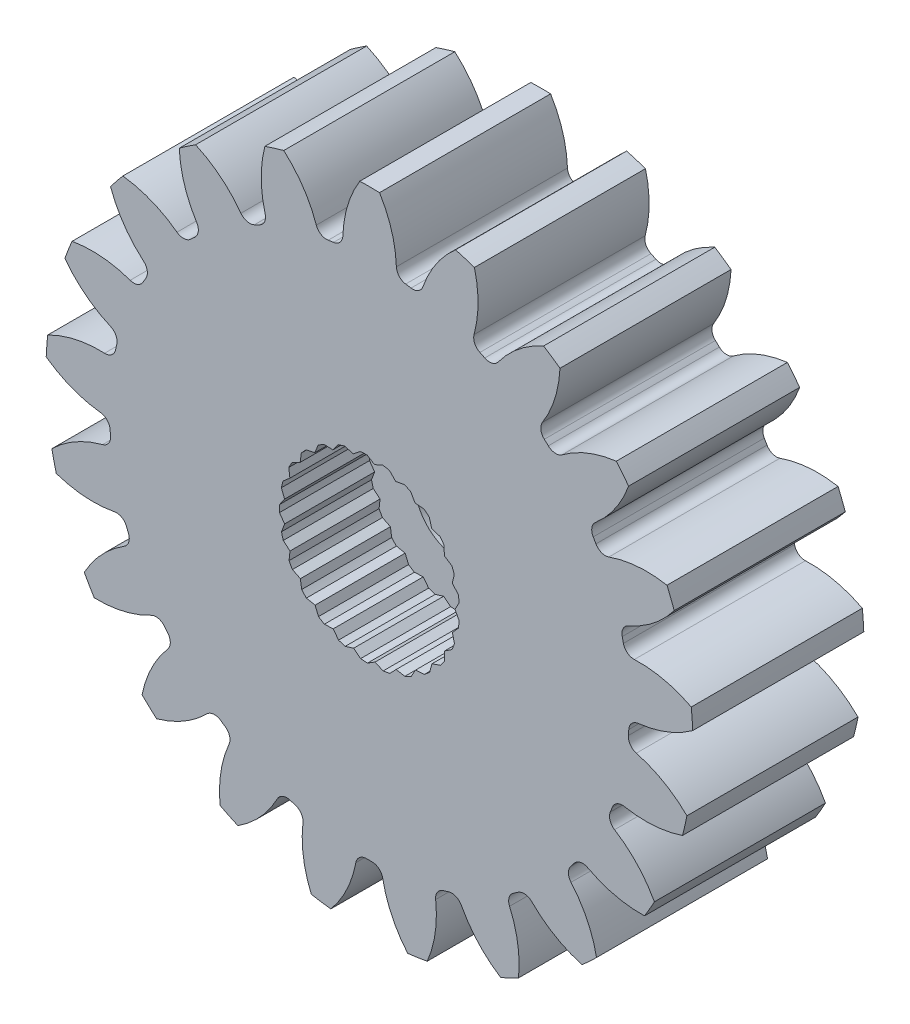
from build123d import *

# Parameters (mm, degrees)
SKETCH3_R           = 9.128125
GEARBODY_DEPTH      = 4.825999939
TOOTHCUT_DEPTH      = 14.781712791
CIRPATTERN1_COUNT   = 21
BOREDIA_R           = 3.175
BORE_DEPTH          = 12700
BOSS_EXTRUDE2_START = -4.825999939
SKETCH5_R           = 3.175
SKETCH5_R_2         = 1.27
BOSS_EXTRUDE2_DEPTH = 4.825999939
CUT_EXTRUDE1_DEPTH  = 2.54


with BuildPart() as part:
    # Sketch3 → gearBody (new body)
    with BuildSketch(Plane.XY):
        Circle(SKETCH3_R)
    extrude(amount=GEARBODY_DEPTH)

    # Sketch2 → toothCut (cut, through all)
    with BuildSketch(Plane.XY):
        with BuildLine():
            ThreePointArc((7.304063332, -0.62874438), (7.31024236, -0.552283711), (7.315621001, -0.475762574))
            ThreePointArc((7.315621001, -0.475762574), (7.399225293, -0.285539875), (7.585558497, -0.193592662))
            ThreePointArc((7.585558497, -0.193592662), (8.887880924, 0.24520489), (9.887327956, 1.188440081))
            ThreePointArc((9.887327956, 1.188440081), (9.930197113, -0.750219466), (9.596548254, -2.660433339))
            ThreePointArc((9.596548254, -2.660433339), (8.750158222, -1.577746445), (7.528543363, -0.948267191))
            ThreePointArc((7.528543363, -0.948267191), (7.358139402, -0.829368735), (7.304063332, -0.62874438))
        make_face()
    toothcut = extrude(amount=TOOTHCUT_DEPTH, mode=Mode.SUBTRACT)

    # CirPattern1: toothCut ×21 about axis
    cirpattern1_axis = Axis((0, 0, 0), (0, 0, 1))
    for i in range(1, CIRPATTERN1_COUNT):
        add(toothcut.rotate(cirpattern1_axis, i * 360 / CIRPATTERN1_COUNT), mode=Mode.SUBTRACT)

    # boreDia → bore (cut, symmetric)
    with BuildSketch(Plane.XY):
        Circle(BOREDIA_R)
    extrude(amount=BORE_DEPTH, both=True, mode=Mode.SUBTRACT)

    # Sketch5 → Boss-Extrude2 (add)
    with BuildSketch(Plane(origin=(0, 0, 0), x_dir=(-1, 0, 0), z_dir=(0, 0, -1)).offset(BOSS_EXTRUDE2_START)):
        Circle(SKETCH5_R)
        Circle(SKETCH5_R_2, mode=Mode.SUBTRACT)
    extrude(amount=BOSS_EXTRUDE2_DEPTH)

    # Sketch4 → Cut-Extrude1 (cut)
    with BuildSketch(Plane.XY.offset(4.825999939)):
        with BuildLine():
            Line((-2.483961558, 0.5305987), (-2.394716355, 0.296483692))
            Line((-2.394716355, 0.296483692), (-2.538362097, 0.091202315))
            ThreePointArc((-2.538362097, 0.091202315), (-2.539992169, -0.006307068), (-2.537877868, -0.103807154))
            Line((-2.537877868, -0.103807154), (-2.393214433, -0.308372628))
            Line((-2.393214433, -0.308372628), (-2.481295878, -0.542927957))
            ThreePointArc((-2.481295878, -0.542927957), (-2.458625141, -0.637779286), (-2.432329979, -0.731690422))
            Line((-2.432329979, -0.731690422), (-2.241338047, -0.893852763))
            Line((-2.241338047, -0.893852763), (-2.268320713, -1.142944069))
            ThreePointArc((-2.268320713, -1.142944069), (-2.222773652, -1.229177486), (-2.173949851, -1.31359889))
            Line((-2.173949851, -1.31359889), (-1.948630148, -1.42316884))
            Line((-1.948630148, -1.42316884), (-1.912818615, -1.671144801))
            ThreePointArc((-1.912818615, -1.671144801), (-1.84725712, -1.743341943), (-1.77897246, -1.812969108))
            Line((-1.77897246, -1.812969108), (-1.53348265, -1.863061986))
            Line((-1.53348265, -1.863061986), (-1.437127089, -2.09434136))
            ThreePointArc((-1.437127089, -2.09434136), (-1.35567063, -2.147965815), (-1.272215685, -2.19842381))
            Line((-1.272215685, -2.19842381), (-1.021980798, -2.185892095))
            Line((-1.021980798, -2.185892095), (-0.871135582, -2.385942748))
            ThreePointArc((-0.871135582, -2.385942748), (-0.778902368, -2.417625095), (-0.685520921, -2.445743459))
            Line((-0.685520921, -2.445743459), (-0.446264133, -2.371374564))
            Line((-0.446264133, -2.371374564), (-0.250407423, -2.527626579))
            ThreePointArc((-0.250407423, -2.527626579), (-0.153192805, -2.535376099), (-0.055752356, -2.539388051))
            Line((-0.055752356, -2.539388051), (0.157492948, -2.407854848))
            Line((0.157492948, -2.407854848), (0.386054755, -2.510490336))
            ThreePointArc((0.386054755, -2.510490336), (0.482142424, -2.493820098), (0.577519335, -2.473473553))
            Line((0.577519335, -2.473473553), (0.751354168, -2.293040757))
            Line((0.751354168, -2.293040757), (0.998259694, -2.335610752))
            ThreePointArc((0.998259694, -2.335610752), (1.087182872, -2.295568209), (1.174503362, -2.252141615))
            Line((1.174503362, -2.252141615), (1.298005042, -2.034146482))
            Line((1.298005042, -2.034146482), (1.547740304, -2.013976155))
            ThreePointArc((1.547740304, -2.013976155), (1.623911622, -1.953077327), (1.697689023, -1.889299336))
            Line((1.697689023, -1.889299336), (1.763097486, -1.647439302))
            Line((1.763097486, -1.647439302), (1.999970699, -1.565796029))
            ThreePointArc((1.999970699, -1.565796029), (2.058604032, -1.487867413), (2.114202639, -1.407745432))
            Line((2.114202639, -1.407745432), (2.117408031, -1.157217452))
            Line((2.117408031, -1.157217452), (2.326535579, -1.01923118))
            ThreePointArc((2.326535579, -1.01923118), (2.36394678, -0.929169318), (2.397873128, -0.837737704))
            Line((2.397873128, -0.837737704), (2.338674041, -0.594283374))
            Line((2.338674041, -0.594283374), (2.506915673, -0.408624287))
            ThreePointArc((2.506915673, -0.408624287), (2.520754058, -0.312088097), (2.53087643, -0.215091836))
            Line((2.53087643, -0.215091836), (2.412992561, 0.005991715))
            Line((2.412992561, 0.005991715), (2.529777035, 0.227657972))
            ThreePointArc((2.529777035, 0.227657972), (2.519173087, 0.324602767), (2.504855457, 0.421069043))
            Line((2.504855457, 0.421069043), (2.335693884, 0.605890322))
            Line((2.335693884, 0.605890322), (2.393683202, 0.849635644))
            ThreePointArc((2.393683202, 0.849635644), (2.359303207, 0.940897645), (2.321445204, 1.030772606))
            Line((2.321445204, 1.030772606), (2.11163497, 1.167718611))
            Line((2.11163497, 1.167718611), (2.107185451, 1.418227583))
            ThreePointArc((2.107185451, 1.418227583), (2.051189629, 1.498072463), (1.992170011, 1.575708935))
            Line((1.992170011, 1.575708935), (1.754894264, 1.656174846))
            Line((1.754894264, 1.656174846), (1.688285487, 1.897707067))
            ThreePointArc((1.688285487, 1.897707067), (1.614192263, 1.96111788), (1.53771945, 2.021637676))
            Line((1.53771945, 2.021637676), (1.287887098, 2.040567525))
            Line((1.287887098, 2.040567525), (1.163304338, 2.257946638))
            ThreePointArc((1.163304338, 2.257946638), (1.075769261, 2.300939047), (0.98664832, 2.340539488))
            Line((0.98664832, 2.340539488), (0.739957249, 2.296743841))
            Line((0.739957249, 2.296743841), (0.565228498, 2.476311116))
            ThreePointArc((0.565228498, 2.476311116), (0.469751719, 2.496183752), (0.373582448, 2.512376595))
            Line((0.373582448, 2.512376595), (0.145533165, 2.408607294))
            Line((0.145533165, 2.408607294), (-0.068362727, 2.53907986))
            ThreePointArc((-0.068362727, 2.53907986), (-0.16578205, 2.534584051), (-0.262956984, 2.526351841))
            Line((-0.262956984, 2.526351841), (-0.458035303, 2.369129093))
            Line((-0.458035303, 2.369129093), (-0.69765847, 2.442308879))
            ThreePointArc((-0.69765847, 2.442308879), (-0.790899124, 2.413727113), (-0.882973861, 2.38158711))
            Line((-0.882973861, 2.38158711), (-1.032823729, 2.180789799))
            Line((-1.032823729, 2.180789799), (-1.283117766, 2.192078648))
            ThreePointArc((-1.283117766, 2.192078648), (-1.366321097, 2.141206823), (-1.447510243, 2.087178501))
            Line((-1.447510243, 2.087178501), (-1.542716041, 1.85542346))
            Line((-1.542716041, 1.85542346), (-1.787954053, 1.804112054))
            ThreePointArc((-1.787954053, 1.804112054), (-1.855892091, 1.734146634), (-1.921094233, 1.661624792))
            Line((-1.921094233, 1.661624792), (-1.955673831, 1.413474042))
            Line((-1.955673831, 1.413474042), (-2.180446612, 1.302786465))
            ThreePointArc((-2.180446612, 1.302786465), (-2.228850559, 1.218123634), (-2.273968807, 1.131665085))
            Line((-2.273968807, 1.131665085), (-2.245749441, 0.882710852))
            Line((-2.245749441, 0.882710852), (-2.435933691, 0.71960201))
            ThreePointArc((-2.435933691, 0.71960201), (-2.461762149, 0.625561446), (-2.483961558, 0.5305987))
        make_face()
    extrude(amount=-CUT_EXTRUDE1_DEPTH, mode=Mode.SUBTRACT)


solid = part.part
